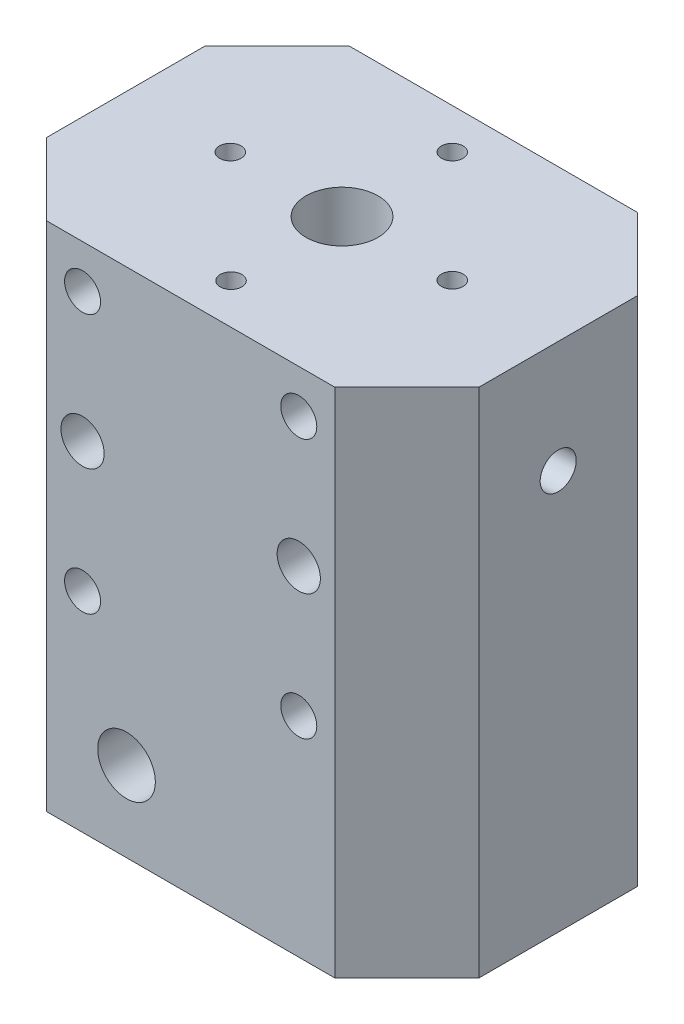
from build123d import *

# Parameters (mm, degrees)
BOSS_EXTRUDE1_START = -71
SKETCH2_W           = 60
SKETCH2_H           = 42
SKETCH2_R           = 7.5
BOSS_EXTRUDE1_DEPTH = 71
SKETCH3_R           = 2.5
SKETCH3_R_2         = 3
SKETCH3_R_3         = 4
CUT_EXTRUDE1_DEPTH  = 97.89169211
SKETCH7_R           = 2.5
CUT_EXTRUDE3_DEPTH  = 81
SKETCH10_R          = 1.25
SKETCH10_R_2        = 0.05
BOSS_EXTRUDE2_DEPTH = 8
CHAMFER10_SIZE      = 1
SKETCH12_R          = 1.5
CUT_EXTRUDE5_DEPTH  = 5
CHAMFER11_SIZE      = 10


with BuildPart() as part:
    # Sketch1 → Revolve1 (revolve)
    with BuildSketch(Plane.XY, mode=Mode.PRIVATE) as revolve1_sk:
        Polygon((0.05, 0), (5, 11.25), (5, 82), (7.5, 82), (7.5, 11.25), (2.55, 0), align=None)
    revolve(revolve1_sk.sketch.rotate(Axis((0, 0, 0), (0, 1, 0)), 90), axis=Axis((0, 0, 0), (0, 1, 0)))

    # Sketch2 → Boss-Extrude1 (add)
    with BuildSketch(Plane(origin=(0, 82, 0), x_dir=(1, 0, 0), z_dir=(0, 1, 0)).offset(BOSS_EXTRUDE1_START)):
        Rectangle(SKETCH2_W, SKETCH2_H)
        with Locations(Location((0, 0, 0), (0, 0, 270))):
            Circle(SKETCH2_R, mode=Mode.SUBTRACT)
    extrude(amount=BOSS_EXTRUDE1_DEPTH)

    # Sketch3 → Cut-Extrude1 (cut, through all)
    with BuildSketch(Plane.XY.offset(21)):
        with Locations((-15, 76)):
            Circle(SKETCH3_R)
        with Locations((-15, 58)):
            Circle(SKETCH3_R_2)
        with Locations((-15, 40)):
            Circle(SKETCH3_R)
        with Locations((15, 76)):
            Circle(SKETCH3_R)
        with Locations((15, 58)):
            Circle(SKETCH3_R_2)
        with Locations((15, 40)):
            Circle(SKETCH3_R)
        with Locations((-8.9, 22.1)):
            Circle(SKETCH3_R_3)
    extrude(amount=-CUT_EXTRUDE1_DEPTH, mode=Mode.SUBTRACT)

    # Sketch7 → Cut-Extrude3 (cut)
    with BuildSketch(Plane(origin=(0, 0, 0), x_dir=(0, 0, 1), z_dir=(-0.9981461553891549, -0.0608625704505587, 0))):
        with Locations(Location((0, 64.5, 0), (0, 0, 270))):
            Circle(SKETCH7_R)
    extrude(amount=-CUT_EXTRUDE3_DEPTH, mode=Mode.SUBTRACT)

    # Sketch10 → Boss-Extrude2 (add)
    with BuildSketch(Plane.XZ):
        with Locations(Location((0, 0, 0), (0, 0, 270))):
            Circle(SKETCH10_R)
        with Locations(Location((0, 0, 0), (0, 0, 90))):
            Circle(SKETCH10_R_2, mode=Mode.SUBTRACT)
    extrude(amount=BOSS_EXTRUDE2_DEPTH)

    # Chamfer10
    chamfer10_edges = [part.edges().sort_by_distance(p)[0] for p in [
        (0, -8, 1.25),
    ]]
    chamfer(chamfer10_edges, length=CHAMFER10_SIZE)

    # Sketch12 → Cut-Extrude5 (cut)
    with BuildSketch(Plane(origin=(0, 82, 0), x_dir=(1, 0, 0), z_dir=(0, 1, 0))):
        with Locations(Location((-15.5, 0, 0), (0, 0, 270))):
            Circle(SKETCH12_R)
        with Locations(Location((-0.1, 15.4, 0), (0, 0, 270))):
            Circle(SKETCH12_R)
        with Locations(Location((15.3, 0, 0), (0, 0, 270))):
            Circle(SKETCH12_R)
        with Locations(Location((0, -15.4, 0), (0, 0, 270))):
            Circle(SKETCH12_R)
    extrude(amount=-CUT_EXTRUDE5_DEPTH, mode=Mode.SUBTRACT)

    # Chamfer11
    chamfer11_edges = [part.edges().sort_by_distance(p)[0] for p in [
        (30, 46.5, -21),
        (30, 46.5, 21),
        (-30, 46.5, 21),
        (-30, 46.5, -21),
    ]]
    chamfer(chamfer11_edges, length=CHAMFER11_SIZE)


solid = part.part
